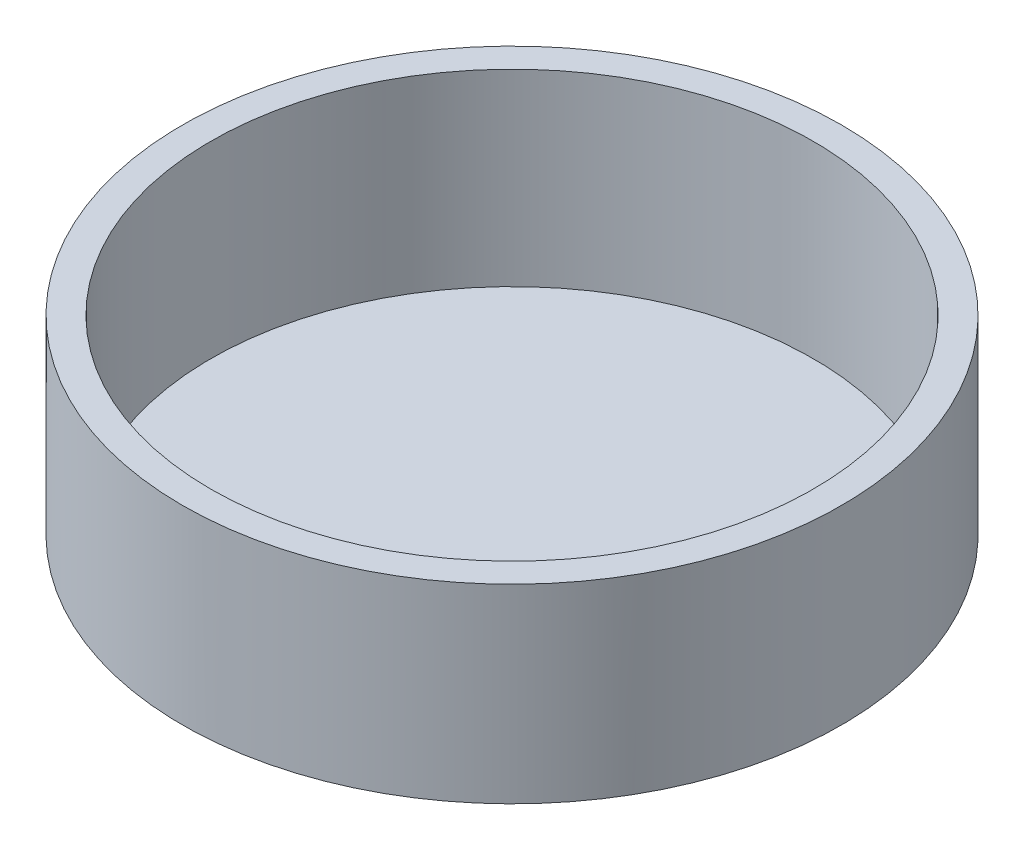
from build123d import *

# Parameters (mm, degrees)
SKETCH1_R           = 17.5
SKETCH1_R_2         = 16
BOSS_EXTRUDE1_DEPTH = 10
BOSS_EXTRUDE2_START = 0.1
SKETCH2_R           = 17.5
BOSS_EXTRUDE2_DEPTH = 0.1


with BuildPart() as part:
    # Sketch1 → Boss-Extrude1 (new body)
    with BuildSketch(Plane(origin=(0, 0, 0), x_dir=(1, 0, 0), z_dir=(0, 1, 0))):
        with Locations(Location((0, 0, 0), (0, 0, 270))):
            Circle(SKETCH1_R)
        with Locations(Location((0, 0, 0), (0, 0, 270))):
            Circle(SKETCH1_R_2, mode=Mode.SUBTRACT)
    extrude(amount=BOSS_EXTRUDE1_DEPTH)

    # Sketch2 → Boss-Extrude2 (add)
    with BuildSketch(Plane.XZ.offset(BOSS_EXTRUDE2_START)):
        with Locations(Location((0, 0, 0), (0, 0, 270))):
            Circle(SKETCH2_R)
    extrude(amount=-BOSS_EXTRUDE2_DEPTH)


solid = part.part
